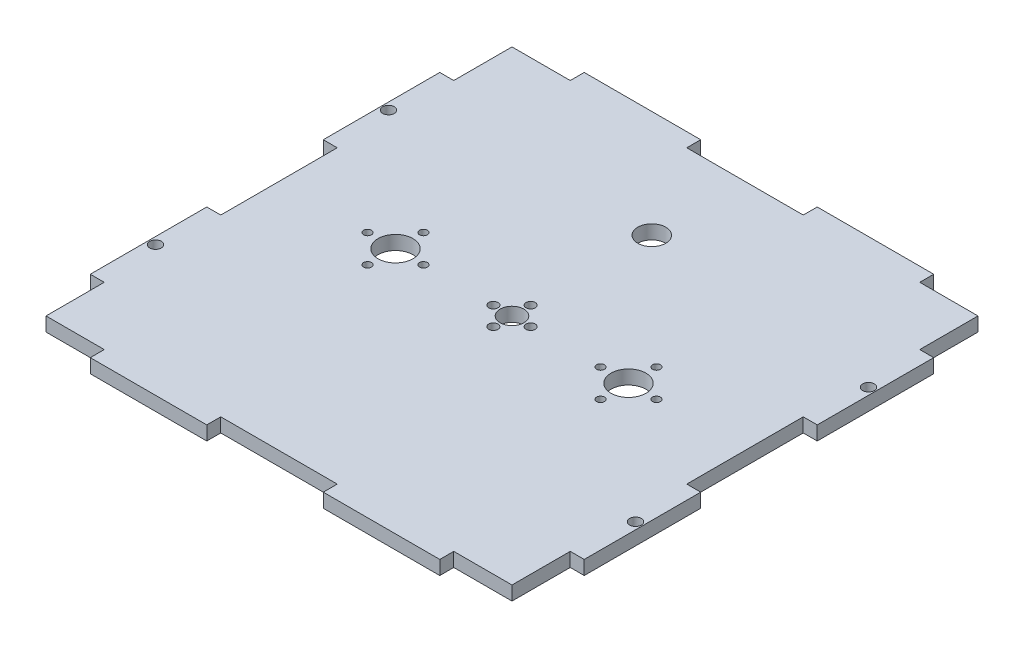
from build123d import *

# Parameters (mm, degrees)
SKETCH_1_R      = 5.1
SKETCH_1_R_2    = 1.7
SKETCH_1_R_3    = 2
SKETCH_1_R_4    = 7.5
SKETCH_1_R_5    = 6
SKETCH_1_R_6    = 2.5
EXTRUDE_1_DEPTH = 6


with BuildPart() as part:
    # 草图1 → 凸台-拉伸1 (new body)
    with BuildSketch(Plane(origin=(0, 0, 0), x_dir=(1, 0, 0), z_dir=(0, 1, 0))):
        Polygon((0, 200), (25, 200), (25, 206), (75, 206), (75, 200), (125, 200), (125, 206), (175, 206), (175, 200), (200, 200), (200, 175), (206, 175), (206, 125), (200, 125), (200, 75), (206, 75), (206, 25), (200, 25), (200, 0), (175, 0), (175, -6), (125, -6), (125, 0), (75, 0), (75, -6), (25, -6), (25, 0), (0, 0), (0, 25), (-6, 25), (-6, 75), (0, 75), (0, 125), (-6, 125), (-6, 175), (0, 175), align=None)
        with Locations(Location((100, 100, 0), (0, 0, 270))):
            Circle(SKETCH_1_R, mode=Mode.SUBTRACT)
        with Locations(Location((150, 112, 0), (0, 0, 270))):
            Circle(SKETCH_1_R_2, mode=Mode.SUBTRACT)
        with Locations(Location((100, 108, 0), (0, 0, 270))):
            Circle(SKETCH_1_R_3, mode=Mode.SUBTRACT)
        with Locations(Location((108, 100, 0), (0, 0, 270))):
            Circle(SKETCH_1_R_3, mode=Mode.SUBTRACT)
        with Locations(Location((100, 92, 0), (0, 0, 270))):
            Circle(SKETCH_1_R_3, mode=Mode.SUBTRACT)
        with Locations(Location((92, 100, 0), (0, 0, 270))):
            Circle(SKETCH_1_R_3, mode=Mode.SUBTRACT)
        with Locations(Location((50, 100, 0), (0, 0, 270))):
            Circle(SKETCH_1_R_4, mode=Mode.SUBTRACT)
        with Locations(Location((50, 112, 0), (0, 0, 270))):
            Circle(SKETCH_1_R_2, mode=Mode.SUBTRACT)
        with Locations(Location((62, 100, 0), (0, 0, 270))):
            Circle(SKETCH_1_R_2, mode=Mode.SUBTRACT)
        with Locations(Location((50, 88, 0), (0, 0, 270))):
            Circle(SKETCH_1_R_2, mode=Mode.SUBTRACT)
        with Locations(Location((38, 100, 0), (0, 0, 270))):
            Circle(SKETCH_1_R_2, mode=Mode.SUBTRACT)
        with Locations(Location((162, 100, 0), (0, 0, 270))):
            Circle(SKETCH_1_R_2, mode=Mode.SUBTRACT)
        with Locations(Location((138, 100, 0), (0, 0, 270))):
            Circle(SKETCH_1_R_2, mode=Mode.SUBTRACT)
        with Locations(Location((150, 88, 0), (0, 0, 270))):
            Circle(SKETCH_1_R_2, mode=Mode.SUBTRACT)
        with Locations(Location((150, 100, 0), (0, 0, 270))):
            Circle(SKETCH_1_R_4, mode=Mode.SUBTRACT)
        with Locations(Location((100, 160, 0), (0, 0, 270))):
            Circle(SKETCH_1_R_5, mode=Mode.SUBTRACT)
        with Locations(Location((-3, 150, 0), (0, 0, 270))):
            Circle(SKETCH_1_R_6, mode=Mode.SUBTRACT)
        with Locations(Location((203, 150, 0), (0, 0, 270))):
            Circle(SKETCH_1_R_6, mode=Mode.SUBTRACT)
        with Locations(Location((203, 50, 0), (0, 0, 270))):
            Circle(SKETCH_1_R_6, mode=Mode.SUBTRACT)
        with Locations(Location((-3, 50, 0), (0, 0, 270))):
            Circle(SKETCH_1_R_6, mode=Mode.SUBTRACT)
    extrude(amount=EXTRUDE_1_DEPTH)


solid = part.part
